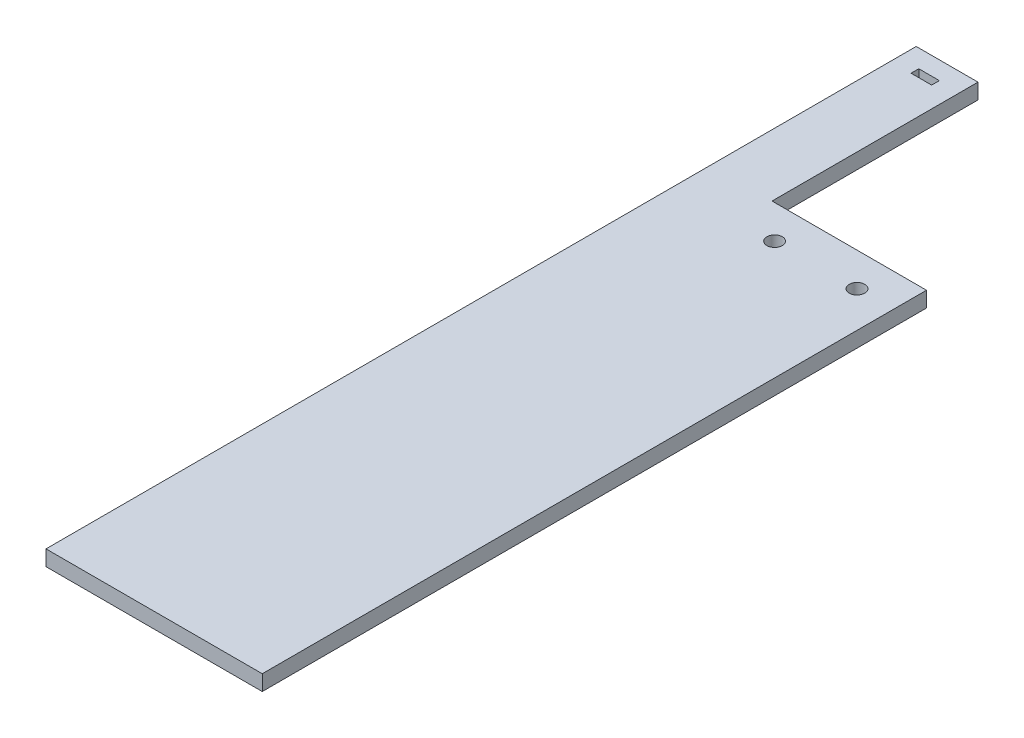
from build123d import *

# Parameters (mm, degrees)
SKETCH1_R           = 1.5
SKETCH1_W           = 4
SKETCH1_H           = 1.5
BOSS_EXTRUDE1_DEPTH = 3


with BuildPart() as part:
    # Sketch1 → Boss-Extrude1 (new body)
    with BuildSketch(Plane(origin=(0, 0, 0), x_dir=(1, 0, 0), z_dir=(0, 1, 0))):
        Polygon((0, 129), (0, 169), (12, 169), (12, 129), (42, 129), (42, 0), (0, 0), align=None)
        with Locations(Location((19, 122.5, 0), (0, 0, 270))):
            Circle(SKETCH1_R, mode=Mode.SUBTRACT)
        with Locations(Location((35, 122.5, 0), (0, 0, 270))):
            Circle(SKETCH1_R, mode=Mode.SUBTRACT)
        with Locations((6, 164.75)):
            Rectangle(SKETCH1_W, SKETCH1_H, mode=Mode.SUBTRACT)
    extrude(amount=BOSS_EXTRUDE1_DEPTH)


solid = part.part
